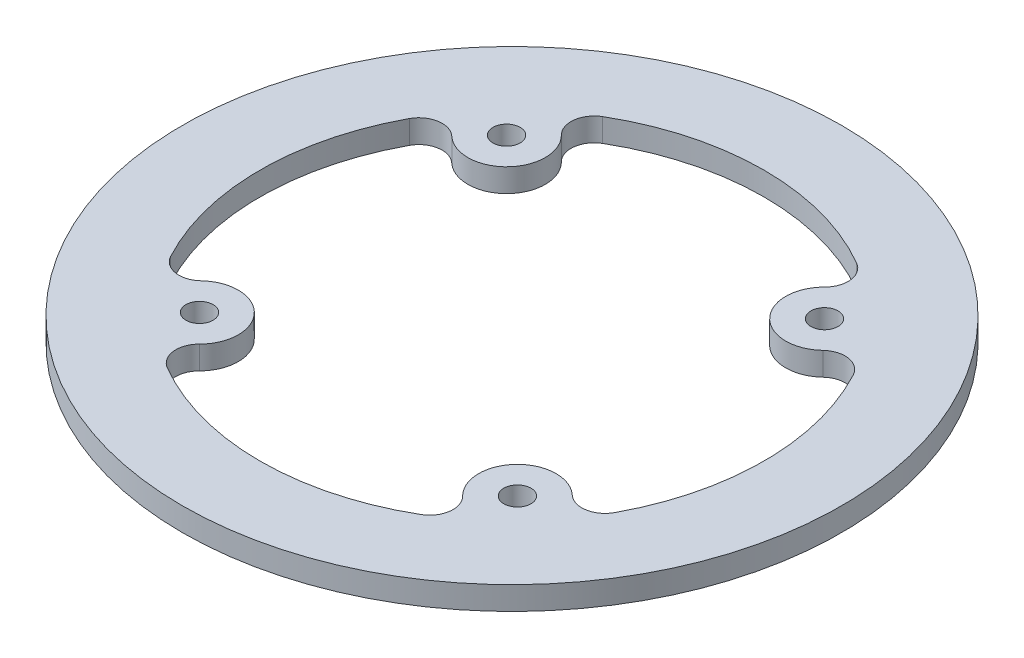
from build123d import *

# Parameters (mm, degrees)
SKETCH_1_R          = 45
SKETCH_1_R_2        = 2
EXTRUDE_1_DEPTH     = 3
CUT_EXTRUDE_1_DEPTH = 64.710281745
FILLET_1_R          = 3
MOVE_FACE_1_BY      = 2.5
MOVE_FACE_2_BY      = 0.15
MOVE_FACE_2_2_BY    = 0.15
MOVE_FACE_2_3_BY    = 0.15
MOVE_FACE_2_4_BY    = 0.15
MOVE_FACE_3_BY      = 0.4
MOVE_FACE_3_2_BY    = 0.4
MOVE_FACE_3_3_BY    = 0.4
MOVE_FACE_3_4_BY    = 0.4


with BuildPart() as part:
    # ｽｹｯﾁ1 → ﾎﾞｽ - 押し出し1 (new body)
    with BuildSketch(Plane(origin=(0, 0, 0), x_dir=(1, 0, 0), z_dir=(0, 1, 0))):
        with Locations(Location((0, 0, 0), (0, 0, 270))):
            Circle(SKETCH_1_R)
        with Locations(Location((-20.5, -19.798989873, 0), (0, 0, 270))):
            Circle(SKETCH_1_R_2, mode=Mode.SUBTRACT)
        with Locations(Location((20.5, -19.798989873, 0), (0, 0, 90))):
            Circle(SKETCH_1_R_2, mode=Mode.SUBTRACT)
        with Locations(Location((20.5, 19.798989873, 0), (0, 0, 270))):
            Circle(SKETCH_1_R_2, mode=Mode.SUBTRACT)
        with Locations(Location((-20.5, 19.798989873, 0), (0, 0, 90))):
            Circle(SKETCH_1_R_2, mode=Mode.SUBTRACT)
    extrude(amount=EXTRUDE_1_DEPTH)

    # ｽｹｯﾁ2 → ｶｯﾄ - 押し出し1 (cut, through all)
    with BuildSketch(Plane(origin=(0, 3, 0), x_dir=(1, 0, 0), z_dir=(0, 1, 0))):
        with BuildLine():
            ThreePointArc((25.486471606, -20.166550649), (30.696582279, -10.675665619), (32.5, 0))
            ThreePointArc((32.5, 0), (30.696582279, 10.675665619), (25.486471606, 20.166550649))
            ThreePointArc((25.486471606, 20.166550649), (25.496616757, 19.9828947), (25.5, 19.798989873))
            ThreePointArc((25.5, 19.798989873), (16.778183392, 16.460115641), (21.040767545, 24.769660901))
            ThreePointArc((21.040767545, 24.769660901), (0, 32.5), (-21.040767545, 24.769660901))
            ThreePointArc((-21.040767545, 24.769660901), (-17.161125768, 23.520806481), (-15.5, 19.798989873))
            ThreePointArc((-15.5, 19.798989873), (-20.683904827, 14.802373116), (-25.486471606, 20.166550649))
            ThreePointArc((-25.486471606, 20.166550649), (-32.5, 0), (-25.486471606, -20.166550649))
            ThreePointArc((-25.486471606, -20.166550649), (-20.683904827, -14.802373116), (-15.5, -19.798989873))
            ThreePointArc((-15.5, -19.798989873), (-17.161125768, -23.520806481), (-21.040767545, -24.769660901))
            ThreePointArc((-21.040767545, -24.769660901), (0, -32.5), (21.040767545, -24.769660901))
            ThreePointArc((21.040767545, -24.769660901), (16.778183392, -16.460115641), (25.5, -19.798989873))
            ThreePointArc((25.5, -19.798989873), (25.496616757, -19.9828947), (25.486471606, -20.166550649))
        make_face()
    extrude(amount=-CUT_EXTRUDE_1_DEPTH, mode=Mode.SUBTRACT)

    # ﾌｨﾚｯﾄ1
    fillet_1_edges = [part.edges().sort_by_distance(p)[0] for p in [
        (21.040767545, 1.5, -24.769660901),
        (25.486471606, 1.5, -20.166550649),
        (25.486471606, 1.5, 20.166550649),
        (21.040767545, 1.5, 24.769660901),
        (-21.040767545, 1.5, 24.769660901),
        (-25.486471606, 1.5, 20.166550649),
        (-25.486471606, 1.5, -20.166550649),
        (-21.040767545, 1.5, -24.769660901),
    ]]
    fillet(fillet_1_edges, radius=FILLET_1_R)

    # Move Face 1: a curved face moved inward by 2.5
    add(Solid.thicken(part.faces().sort_by_distance((0, 1.5, -45))[0], -MOVE_FACE_1_BY), mode=Mode.SUBTRACT)

    # Move Face 2: a curved face moved inward by 0.15
    add(Solid.thicken(part.faces().sort_by_distance((20.5, 1.5, -21.798989873))[0], -MOVE_FACE_2_BY), mode=Mode.SUBTRACT)

    # Move Face 2 2: a curved face moved inward by 0.15
    add(Solid.thicken(part.faces().sort_by_distance((-20.5, 1.5, -17.798989873))[0], -MOVE_FACE_2_2_BY), mode=Mode.SUBTRACT)

    # Move Face 2 3: a curved face moved inward by 0.15
    add(Solid.thicken(part.faces().sort_by_distance((-20.5, 1.5, 17.798989873))[0], -MOVE_FACE_2_3_BY), mode=Mode.SUBTRACT)

    # Move Face 2 4: a curved face moved inward by 0.15
    add(Solid.thicken(part.faces().sort_by_distance((20.5, 1.5, 21.798989873))[0], -MOVE_FACE_2_4_BY), mode=Mode.SUBTRACT)

    # Move Face 3: a curved face moved outward by 0.4
    add(Solid.thicken(part.faces().sort_by_distance((-20.5, 1.5, 17.648989873))[0], MOVE_FACE_3_BY))

    # Move Face 3 2: a curved face moved outward by 0.4
    add(Solid.thicken(part.faces().sort_by_distance((20.5, 1.5, 21.948989873))[0], MOVE_FACE_3_2_BY))

    # Move Face 3 3: a curved face moved outward by 0.4
    add(Solid.thicken(part.faces().sort_by_distance((20.5, 1.5, -21.948989873))[0], MOVE_FACE_3_3_BY))

    # Move Face 3 4: a curved face moved outward by 0.4
    add(Solid.thicken(part.faces().sort_by_distance((-20.5, 1.5, -17.648989873))[0], MOVE_FACE_3_4_BY))


solid = part.part
